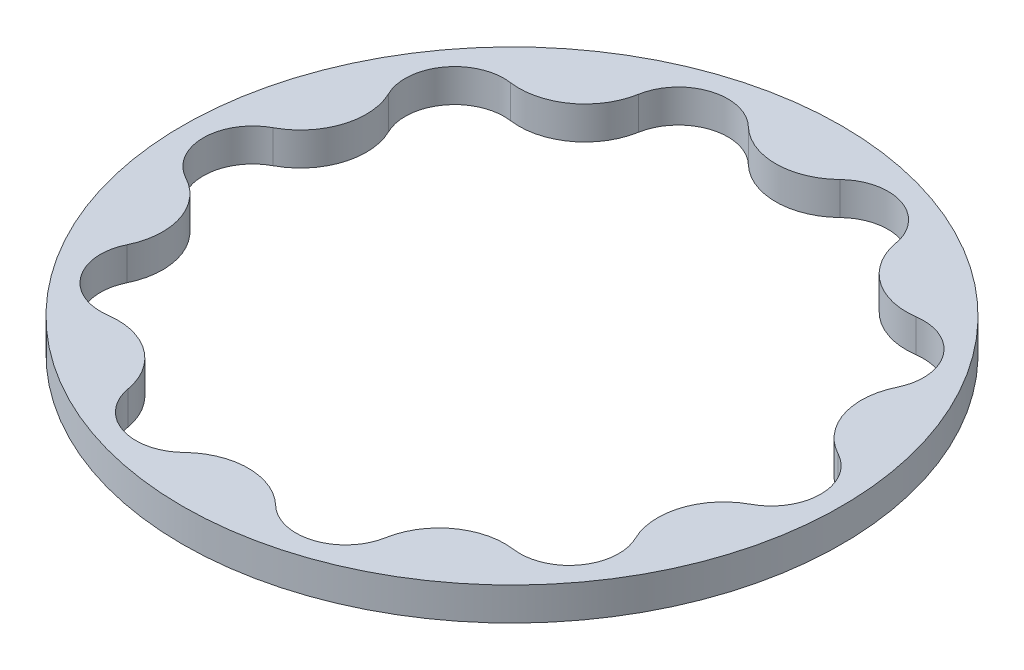
from build123d import *

# Parameters (mm, degrees)
SKETCH1_R           = 100
BOSS_EXTRUDE1_DEPTH = 10


with BuildPart() as part:
    # Sketch1 → Boss-Extrude1 (new body)
    with BuildSketch(Plane(origin=(0, 0, 0), x_dir=(1, 0, 0), z_dir=(0, 1, 0))):
        with Locations(Location((0, 0, 0), (0, 0, 270))):
            Circle(SKETCH1_R)
        with BuildLine():
            ThreePointArc((-13.891883614, 85.611964358), (0, 80), (13.891883614, 85.611964358))
            ThreePointArc((13.891883614, 85.611964358), (28.946051241, 89.086785371), (39.082680141, 77.426978402))
            ThreePointArc((39.082680141, 77.426978402), (47.022820183, 64.72135955), (61.560219997, 61.096089772))
            ThreePointArc((61.560219997, 61.096089772), (75.781745989, 55.058661307), (77.128988455, 39.667518344))
            ThreePointArc((77.128988455, 39.667518344), (76.084521304, 24.72135955), (85.714644696, 13.243585473))
            ThreePointArc((85.714644696, 13.243585473), (93.671389496, 0), (85.714644696, -13.243585473))
            ThreePointArc((85.714644696, -13.243585473), (76.084521304, -24.72135955), (77.128988455, -39.667518344))
            ThreePointArc((77.128988455, -39.667518344), (75.781745989, -55.058661307), (61.560219997, -61.096089772))
            ThreePointArc((61.560219997, -61.096089772), (47.022820183, -64.72135955), (39.082680141, -77.426978402))
            ThreePointArc((39.082680141, -77.426978402), (28.946051241, -89.086785371), (13.891883614, -85.611964358))
            ThreePointArc((13.891883614, -85.611964358), (0, -80), (-13.891883614, -85.611964358))
            ThreePointArc((-13.891883614, -85.611964358), (-28.946051241, -89.086785371), (-39.082680141, -77.426978402))
            ThreePointArc((-39.082680141, -77.426978402), (-47.022820183, -64.72135955), (-61.560219997, -61.096089772))
            ThreePointArc((-61.560219997, -61.096089772), (-75.781745989, -55.058661307), (-77.128988455, -39.667518344))
            ThreePointArc((-77.128988455, -39.667518344), (-76.084521304, -24.72135955), (-85.714644696, -13.243585473))
            ThreePointArc((-85.714644696, -13.243585473), (-93.671389496, 0), (-85.714644696, 13.243585473))
            ThreePointArc((-85.714644696, 13.243585473), (-76.084521304, 24.72135955), (-77.128988455, 39.667518344))
            ThreePointArc((-77.128988455, 39.667518344), (-75.781745989, 55.058661307), (-61.560219997, 61.096089772))
            ThreePointArc((-61.560219997, 61.096089772), (-47.022820183, 64.72135955), (-39.082680141, 77.426978402))
            ThreePointArc((-39.082680141, 77.426978402), (-28.946051241, 89.086785371), (-13.891883614, 85.611964358))
        make_face(mode=Mode.SUBTRACT)
    extrude(amount=BOSS_EXTRUDE1_DEPTH)


solid = part.part
